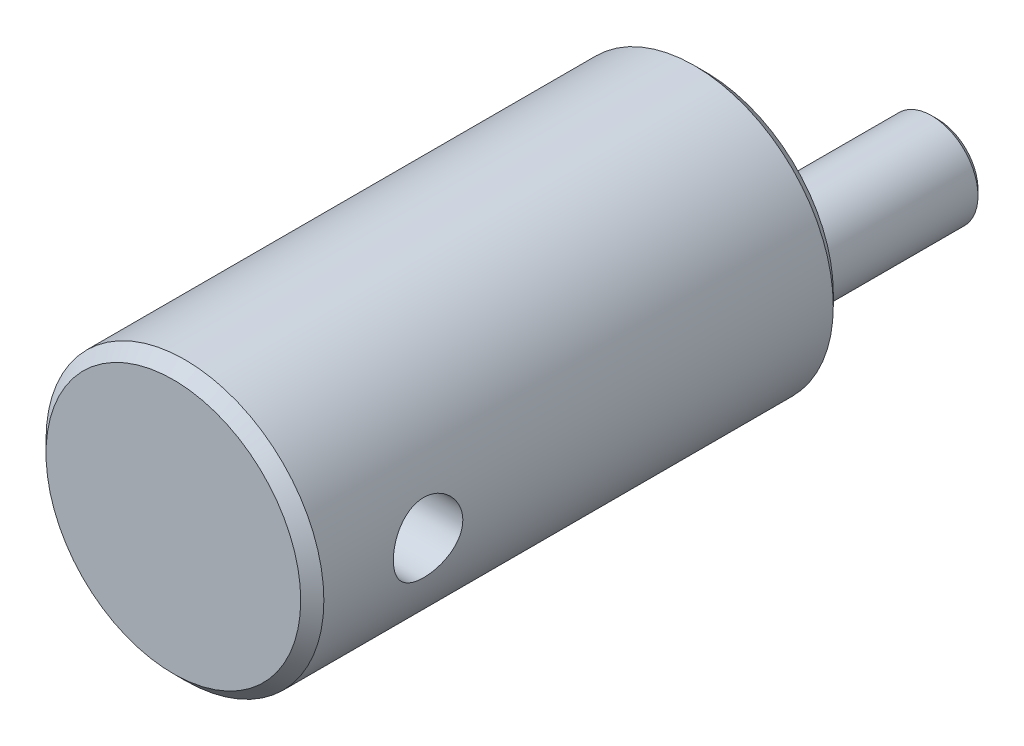
from build123d import *

# Parameters (mm, degrees)
SKETCH1_R               = 6
BOSS_EXTRUDE1_DEPTH     = 23
CHAMFER1_SIZE           = 0.5
SKETCH2_R               = 2
BOSS_EXTRUDE2_DEPTH     = 10
CHAMFER2_SIZE           = 0.25
CUT_EXTRUDE1_DEPTH      = 25.515301344
CUT_EXTRUDE1_DEPTH_BACK = 25.515301344
SKETCH3_R               = 1.5


with BuildPart() as part:
    # Sketch1 → Boss-Extrude1 (new body)
    with BuildSketch(Plane.XY):
        Circle(SKETCH1_R)
    extrude(amount=BOSS_EXTRUDE1_DEPTH)

    # Chamfer1
    chamfer1_edges = [part.edges().sort_by_distance(p)[0] for p in [
        (-6, 0, 0),
        (-6, 0, 23),
    ]]
    chamfer(chamfer1_edges, length=CHAMFER1_SIZE)

    # Sketch2 → Boss-Extrude2 (add)
    with BuildSketch(Plane(origin=(0, 0, 0), x_dir=(-1, 0, 0), z_dir=(0, 0, -1))):
        with Locations(Location((0, -3, 0), (0, 0, 180))):
            Circle(SKETCH2_R)
    extrude(amount=BOSS_EXTRUDE2_DEPTH)

    # Chamfer2
    chamfer2_edges = [part.edges().sort_by_distance(p)[0] for p in [
        (-2, -3, -10),
    ]]
    chamfer(chamfer2_edges, length=CHAMFER2_SIZE)

    # Sketch3 → Cut-Extrude1 (cut, two sides: drawn at the far end of the back side and taken through both)
    with BuildSketch(Plane(origin=(0, 0, 0), x_dir=(0, 0, -1), z_dir=(1, 0, 0)).offset(-CUT_EXTRUDE1_DEPTH_BACK)):
        with Locations((-18, 0)):
            Circle(SKETCH3_R)
    extrude(amount=CUT_EXTRUDE1_DEPTH + CUT_EXTRUDE1_DEPTH_BACK, mode=Mode.SUBTRACT)


solid = part.part
